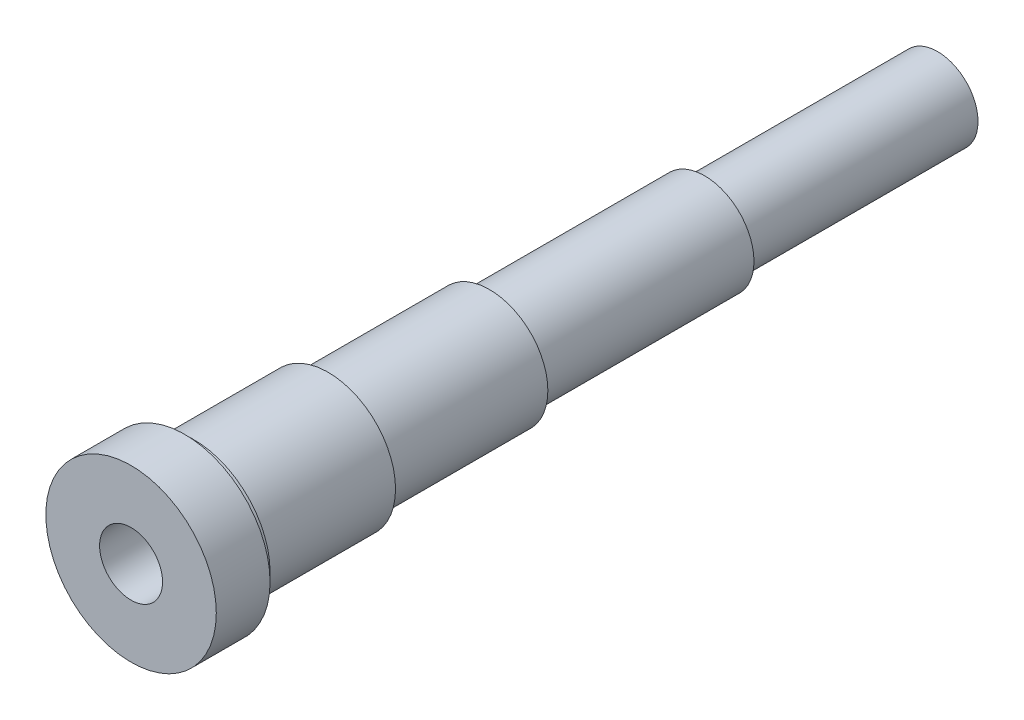
from build123d import *


with BuildPart() as part:
    # Sketch1 → Revolve1 (revolve)
    with BuildSketch(Plane(origin=(0, 0, 0), x_dir=(0, 0, -1), z_dir=(1, 0, 0)), mode=Mode.PRIVATE) as revolve1_sk:
        Polygon((-238.175017721, 18.0848), (-238.175017721, -3.61696), (87.351382279, -3.61696), (87.351382279, 0), (-6.689577721, 0), (-6.689577721, 3.61696), (-93.496617721, 3.61696), (-93.496617721, 7.23392), (-158.601897721, 7.23392), (-158.601897721, 10.85088), (-212.856297721, 10.85088), (-212.856297721, 14.46784), (-216.473257721, 14.46784), (-216.473257721, 18.0848), align=None)
    revolve(revolve1_sk.sketch.rotate(Axis((0, -16.31696, 254.825393325), (0, 0, -1)), 90), axis=Axis((0, -16.31696, 254.825393325), (0, 0, -1)))


solid = part.part
